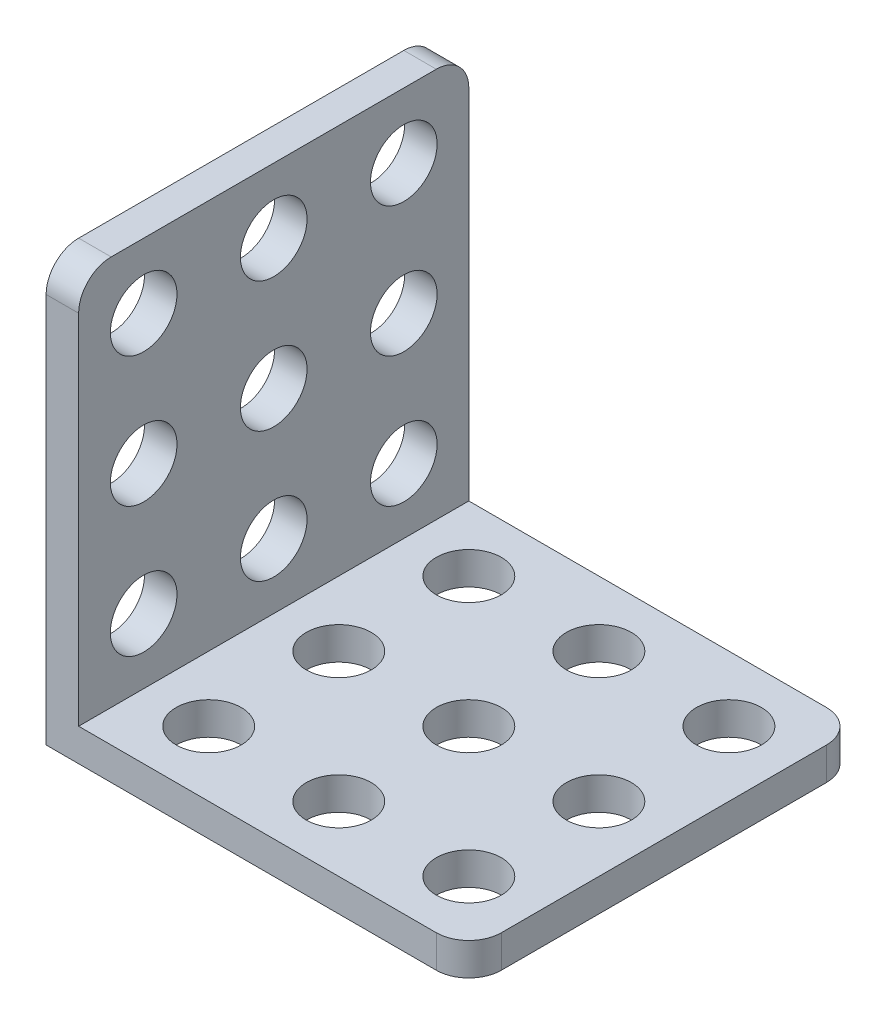
from build123d import *

# Parameters (mm, degrees)
BOSS_EXTRUDE1_DEPTH  = 24
SKETCH2_R            = 2.05
CUT_EXTRUDE1_DEPTH   = 43.755116653
LPATTERN1_COUNT      = 3
LPATTERN1_PITCH      = 8
LPATTERN1_COUNT_DIR2 = 3
LPATTERN1_PITCH_DIR2 = 8
SKETCH3_R            = 2
CUT_EXTRUDE2_DEPTH   = 43.755116653
LPATTERN2_COUNT      = 3
LPATTERN2_PITCH      = 8
LPATTERN2_COUNT_DIR2 = 3
LPATTERN2_PITCH_DIR2 = 8
FILLET1_R            = 2


with BuildPart() as part:
    # Sketch1 → Boss-Extrude1 (new body)
    with BuildSketch(Plane.XY):
        Polygon((0, 0), (0, 26), (2, 26), (2, 2), (26, 2), (26, 0), align=None)
    extrude(amount=BOSS_EXTRUDE1_DEPTH)

    # Sketch2 → Cut-Extrude1 (cut, through all)
    with BuildSketch(Plane(origin=(2, 0, 0), x_dir=(0, 0, -1), z_dir=(1, 0, 0))):
        with Locations(Location((-20, 22, 0), (0, 0, 90))):
            Circle(SKETCH2_R)
    cut_extrude1 = extrude(amount=-CUT_EXTRUDE1_DEPTH, mode=Mode.SUBTRACT)

    # LPattern1: Cut-Extrude1 3 × 3
    with Locations(*[(0, -j * LPATTERN1_PITCH_DIR2, -i * LPATTERN1_PITCH) for i in range(LPATTERN1_COUNT) for j in range(LPATTERN1_COUNT_DIR2) if (i, j) != (0, 0)]):
        add(cut_extrude1, mode=Mode.SUBTRACT)

    # Sketch3 → Cut-Extrude2 (cut, through all)
    with BuildSketch(Plane(origin=(0, 2, 0), x_dir=(1, 0, 0), z_dir=(0, 1, 0))):
        with Locations(Location((22, -4, 0), (0, 0, 270))):
            Circle(SKETCH3_R)
    cut_extrude2 = extrude(amount=-CUT_EXTRUDE2_DEPTH, mode=Mode.SUBTRACT)

    # LPattern2: Cut-Extrude2 3 × 3
    with Locations(*[(-j * LPATTERN2_PITCH_DIR2, 0, i * LPATTERN2_PITCH) for i in range(LPATTERN2_COUNT) for j in range(LPATTERN2_COUNT_DIR2) if (i, j) != (0, 0)]):
        add(cut_extrude2, mode=Mode.SUBTRACT)

    # Fillet1
    fillet1_edges = [part.edges().sort_by_distance(p)[0] for p in [
        (1, 26, 24),
        (1, 26, 0),
        (26, 1, 24),
        (26, 1, 0),
    ]]
    fillet(fillet1_edges, radius=FILLET1_R)


solid = part.part
